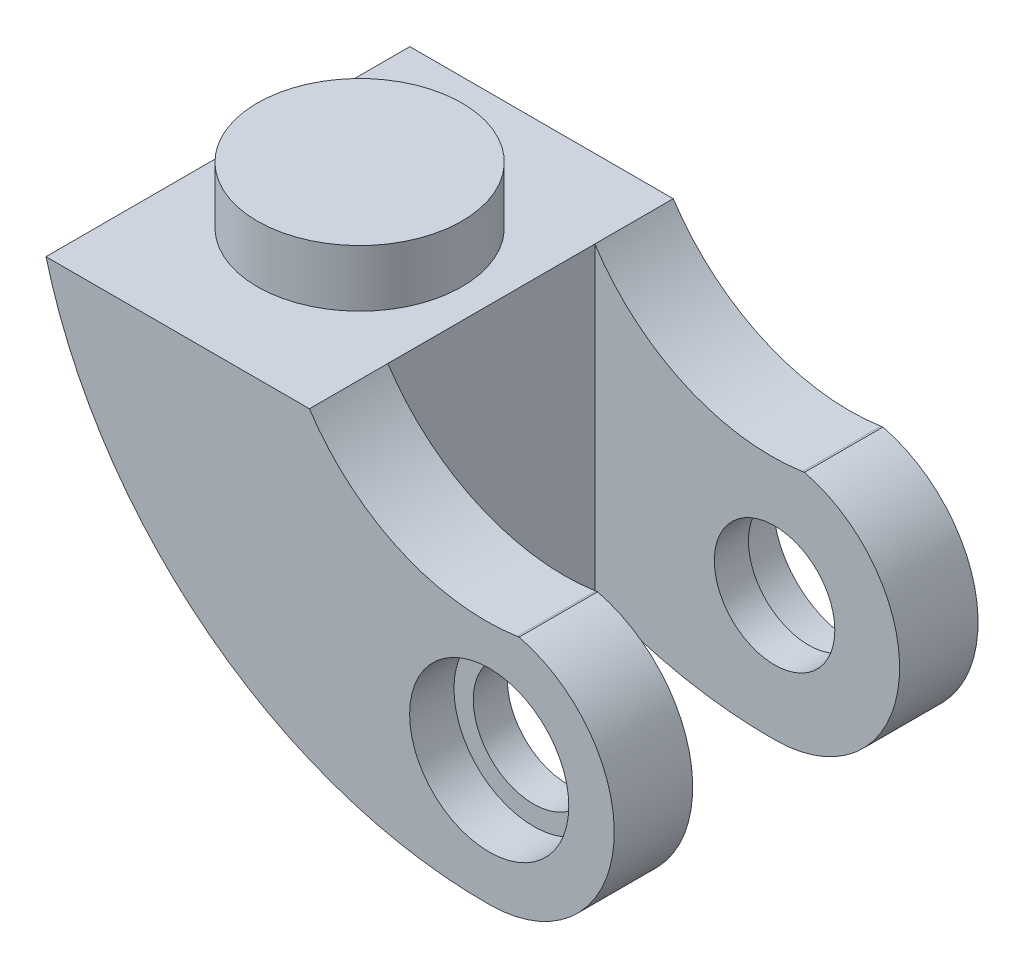
from build123d import *

# Parameters (mm, degrees)
CROQUIS1_R              = 3.5
SALIENTE_EXTRUIR1_DEPTH = 16
CROQUIS2_W              = 18.232700604
CROQUIS2_H              = 9.1
CORTAR_EXTRUIR1_DEPTH   = 22
CROQUIS3_R              = 3.5
CROQUIS3_R_2            = 2.65
SALIENTE_EXTRUIR2_DEPTH = 1.5
SALIENTE_EXTRUIR3_START = -1.5
CROQUIS4_R              = 3.5
CROQUIS4_R_2            = 2.65
SALIENTE_EXTRUIR3_DEPTH = 1.5
CROQUIS5_R              = 4.5
SALIENTE_EXTRUIR4_DEPTH = 2.5


with BuildPart() as part:
    # Croquis1 → Saliente-Extruir1 (new body)
    with BuildSketch(Plane.XY):
        with BuildLine():
            Line((-19.490709772, 9.428309156), (-7.90572953, 9.428309156))
            ThreePointArc((-7.90572953, 9.428309156), (-3.938516352, 6.040037718), (1.230212675, 5.330528037))
            Line((1.230212675, 5.330528037), (1.314384466, 5.340636055))
            ThreePointArc((1.314384466, 5.340636055), (5.463239212, -0.634836445), (0.054718216, -5.499727804))
            ThreePointArc((0.054718216, -5.499727804), (-12.283781153, -1.395117758), (-19.490709772, 9.428309156))
        make_face()
        Circle(CROQUIS1_R, mode=Mode.SUBTRACT)
    extrude(amount=SALIENTE_EXTRUIR1_DEPTH)

    # Croquis2 → Cortar-Extruir1 (cut)
    with BuildSketch(Plane(origin=(0, 9.428309156, 0), x_dir=(1, 0, 0), z_dir=(0, 1, 0))):
        with Locations((1.210620772, -8)):
            Rectangle(CROQUIS2_W, CROQUIS2_H)
    extrude(amount=-CORTAR_EXTRUIR1_DEPTH, mode=Mode.SUBTRACT)

    # Croquis3 → Saliente-Extruir2 (add)
    with BuildSketch(Plane(origin=(0, 0, 12.55), x_dir=(-1, 0, 0), z_dir=(0, 0, -1))):
        Circle(CROQUIS3_R)
        Circle(CROQUIS3_R_2, mode=Mode.SUBTRACT)
    extrude(amount=-SALIENTE_EXTRUIR2_DEPTH)

    # Croquis4 → Saliente-Extruir3 (add)
    with BuildSketch(Plane.XY.offset(3.45).offset(SALIENTE_EXTRUIR3_START)):
        Circle(CROQUIS4_R)
        with Locations(Location((0, 0, 0), (0, 0, 180))):
            Circle(CROQUIS4_R_2, mode=Mode.SUBTRACT)
    extrude(amount=SALIENTE_EXTRUIR3_DEPTH)

    # Croquis5 → Saliente-Extruir4 (add)
    with BuildSketch(Plane(origin=(0, 9.428309156, 0), x_dir=(1, 0, 0), z_dir=(0, 1, 0))):
        with Locations(Location((-13.698219651, -8, 0), (0, 0, 270))):
            Circle(CROQUIS5_R)
    extrude(amount=SALIENTE_EXTRUIR4_DEPTH)


solid = part.part
